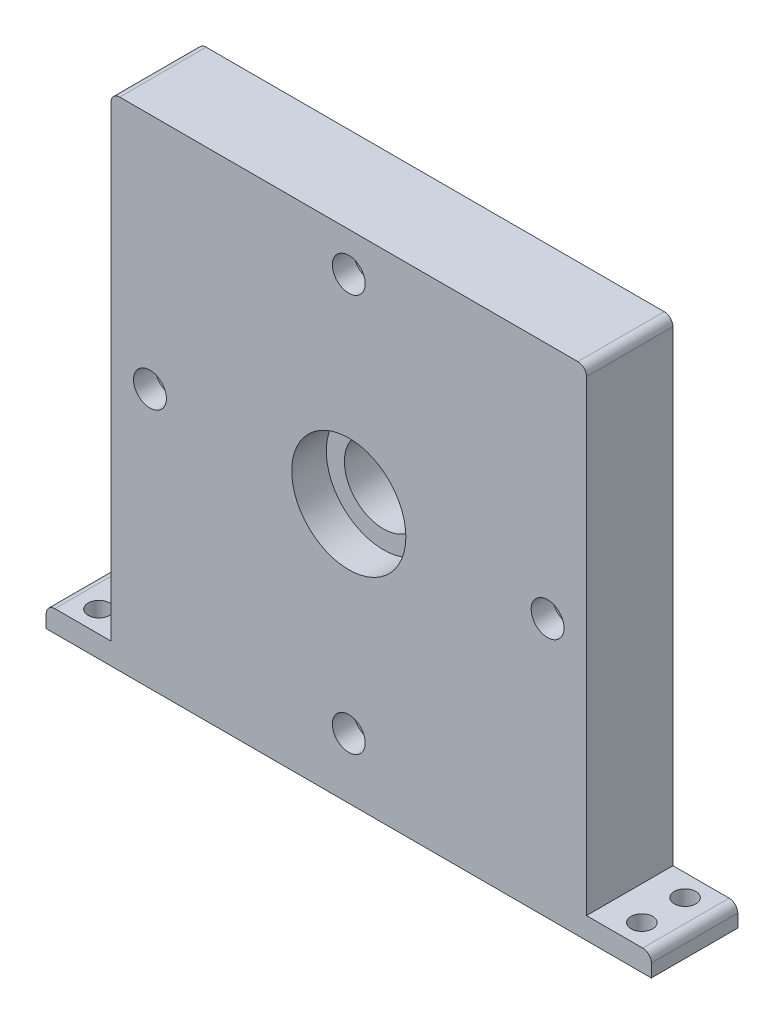
from build123d import *

# Parameters (mm, degrees)
SKETCH1_W               = 139.7
SKETCH1_H               = 12.7
BOSS_EXTRUDE1_DEPTH     = 146.05
SKETCH2_W               = 12.7
SKETCH2_H               = 6.35
BOSS_EXTRUDE2_DEPTH     = 19.05
CUT_EXTRUDE4_REACH      = 213.847
SKETCH6_R               = 3.175
FILLET1_R               = 2.54
SKETCH3_R               = 16.764
CUT_EXTRUDE5_DEPTH      = 10.16
SKETCH7_R               = 11.4554
CUT_EXTRUDE6_DEPTH      = 216.952287786
BOSS_EXTRUDE3_DEPTH     = 12.7
MIRROR3_COPY_1_REACH    = 213.847
MIRROR3_COPY_1_SKETCH_R = 3.175
SKETCH10_R              = 3.3782
CUT_EXTRUDE8_DEPTH      = 218.203418481
SKETCH11_R              = 4.826
CUT_EXTRUDE9_DEPTH      = 6.35
SKETCH12_R              = 11.4554
CUT_EXTRUDE10_DEPTH     = 217.086683995


with BuildPart() as part:
    # Sketch1 → Boss-Extrude1 (new body)
    with BuildSketch(Plane(origin=(0, 0, 0), x_dir=(1, 0, 0), z_dir=(0, 1, 0))):
        with Locations((69.85, 6.35)):
            Rectangle(SKETCH1_W, SKETCH1_H)
    extrude(amount=BOSS_EXTRUDE1_DEPTH)

    # Sketch2 → Boss-Extrude2 (add)
    with BuildSketch(Plane.ZY):
        with Locations((-6.35, 3.175)):
            Rectangle(SKETCH2_W, SKETCH2_H)
    boss_extrude2 = extrude(amount=BOSS_EXTRUDE2_DEPTH)

    # Mirror1: Boss-Extrude2 across plane
    add(boss_extrude2.mirror(Plane.ZY.offset(-69.85)))

    # Sketch6 → Cut-Extrude4 (cut, up to next)
    with BuildSketch(Plane(origin=(0, 6.35, 0), x_dir=(1, 0, 0), z_dir=(0, 1, 0)), mode=Mode.PRIVATE) as cut_extrude4_sk1:
        with Locations(Location((-9.906, 6.35, 0), (0, 0, 270))):
            Circle(SKETCH6_R)
    cut_extrude4_tool1 = extrude(cut_extrude4_sk1.sketch, amount=-CUT_EXTRUDE4_REACH, mode=Mode.PRIVATE) & part.part
    cut_extrude4 = cut_extrude4_tool1.solids().sort_by_distance((-9.906, 6.35, -6.35))[0]
    add(cut_extrude4, mode=Mode.SUBTRACT)

    # Mirror2: Cut-Extrude4 across plane
    add(cut_extrude4.mirror(Plane.ZY.offset(-69.85)), mode=Mode.SUBTRACT)

    # Fillet1
    fillet1_edges = [part.edges().sort_by_distance(p)[0] for p in [
        (139.7, 146.05, -6.35),
        (-19.05, 6.35, -6.35),
        (158.75, 6.35, -6.35),
        (0, 146.05, -6.35),
    ]]
    fillet(fillet1_edges, radius=FILLET1_R)

    # Sketch3 → Cut-Extrude5 (cut)
    with BuildSketch(Plane.XY):
        with Locations((69.85, 76.2)):
            Circle(SKETCH3_R)
    extrude(amount=-CUT_EXTRUDE5_DEPTH, mode=Mode.SUBTRACT)

    # Sketch7 → Cut-Extrude6 (cut, through all)
    with BuildSketch(Plane.XY.offset(-10.16)):
        with Locations((69.85, 76.2)):
            Circle(SKETCH7_R)
    extrude(amount=-CUT_EXTRUDE6_DEPTH, mode=Mode.SUBTRACT)

    # Sketch8 → Boss-Extrude3 (add)
    with BuildSketch(Plane(origin=(0, 0, -12.7), x_dir=(-1, 0, 0), z_dir=(0, 0, -1))):
        with BuildLine():
            Line((-137.16, 146.05), (-2.54, 146.05))
            ThreePointArc((-2.54, 146.05), (-0.743948776, 145.306051224), (0, 143.51))
            Line((0, 143.51), (0, 6.35))
            Line((0, 6.35), (16.51, 6.35))
            ThreePointArc((16.51, 6.35), (18.306051224, 5.606051224), (19.05, 3.81))
            Line((19.05, 3.81), (19.05, 0))
            Line((19.05, 0), (-158.75, 0))
            Line((-158.75, 0), (-158.75, 3.81))
            ThreePointArc((-158.75, 3.81), (-158.006051224, 5.606051224), (-156.21, 6.35))
            Line((-156.21, 6.35), (-139.7, 6.35))
            Line((-139.7, 6.35), (-139.7, 143.51))
            ThreePointArc((-139.7, 143.51), (-138.956051224, 145.306051224), (-137.16, 146.05))
        make_face()
    extrude(amount=BOSS_EXTRUDE3_DEPTH)

    # Mirror3: Cut-Extrude4 across plane
    add(cut_extrude4.mirror(Plane(origin=(0, 0, -12.7), x_dir=(1, 0, 0), z_dir=(0, 0, -1))), mode=Mode.SUBTRACT)

    # Mirror3 copy 1 sketch → Mirror3 copy 1 (cut, up to next)
    with BuildSketch(Plane(origin=(139.7, 6.35, -25.4), x_dir=(-1, 0, 0), z_dir=(0, 1, 0)), mode=Mode.PRIVATE) as mirror3_copy_1_sk1:
        with Locations(Location((-9.906, 6.35, 0), (0, 0, 270))):
            Circle(MIRROR3_COPY_1_SKETCH_R)
    mirror3_copy_1_tool1 = extrude(mirror3_copy_1_sk1.sketch, amount=-MIRROR3_COPY_1_REACH, mode=Mode.PRIVATE) & part.part
    add(mirror3_copy_1_tool1.solids().sort_by_distance((149.606, 6.35, -19.05))[0], mode=Mode.SUBTRACT)

    # Sketch10 → Cut-Extrude8 (cut, through all)
    with BuildSketch(Plane.XY):
        with Locations((11.43, 76.2)):
            Circle(SKETCH10_R)
        with Locations((69.85, 134.62)):
            Circle(SKETCH10_R)
        with Locations((128.27, 76.2)):
            Circle(SKETCH10_R)
        with Locations((69.85, 17.78)):
            Circle(SKETCH10_R)
    extrude(amount=-CUT_EXTRUDE8_DEPTH, mode=Mode.SUBTRACT)

    # Sketch11 → Cut-Extrude9 (cut)
    with BuildSketch(Plane.XY):
        with Locations((11.43, 76.2)):
            Circle(SKETCH11_R)
        with Locations((69.85, 134.62)):
            Circle(SKETCH11_R)
        with Locations((128.27, 76.2)):
            Circle(SKETCH11_R)
        with Locations((69.85, 17.78)):
            Circle(SKETCH11_R)
    extrude(amount=-CUT_EXTRUDE9_DEPTH, mode=Mode.SUBTRACT)

    # Sketch12 → Cut-Extrude10 (cut, through all)
    with BuildSketch(Plane.XY.offset(-12.7)):
        with Locations((69.85, 76.2)):
            Circle(SKETCH12_R)
    extrude(amount=-CUT_EXTRUDE10_DEPTH, mode=Mode.SUBTRACT)


solid = part.part
